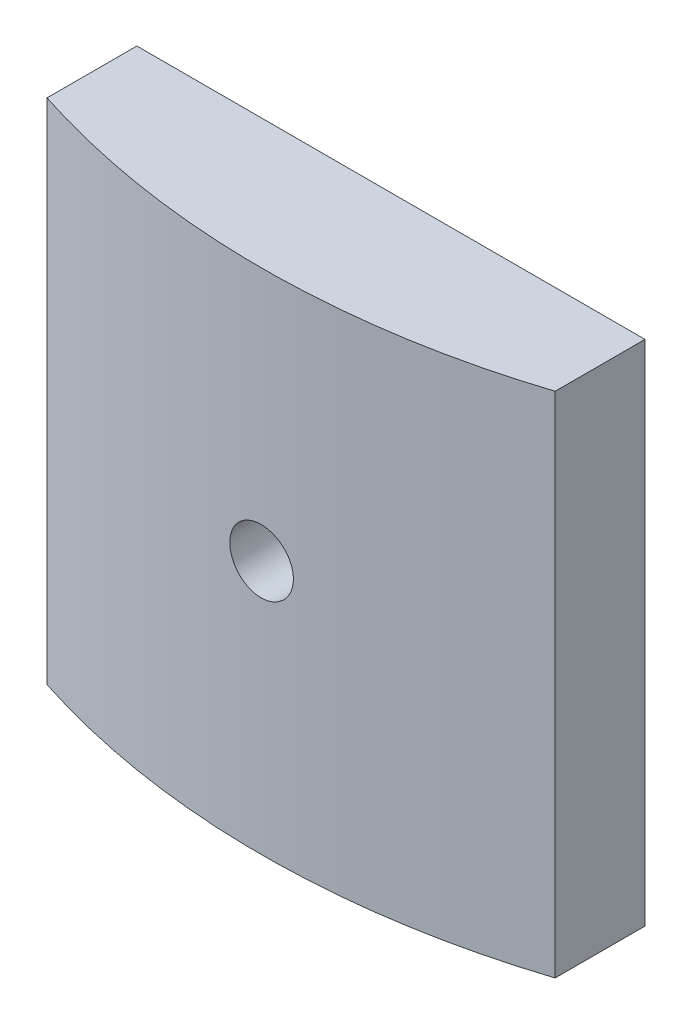
from build123d import *

# Parameters (mm, degrees)
BOSS_EXTRUDE1_DEPTH = 20
SKETCH3_R           = 1.25
CUT_EXTRUDE1_DEPTH  = 20


with BuildPart() as part:
    # Sketch2 → Boss-Extrude1 (new body)
    with BuildSketch(Plane(origin=(0, 0, 0), x_dir=(1, 0, 0), z_dir=(0, 1, 0))):
        with BuildLine():
            Line((0, -27.386127875), (-10, -27.386127875))
            Line((-10, -27.386127875), (-10, -30.923292192))
            ThreePointArc((-10, -30.923292192), (0, -32.5), (10, -30.923292192))
            Line((10, -30.923292192), (10, -27.386127875))
            Line((10, -27.386127875), (0, -27.386127875))
        make_face()
    extrude(amount=BOSS_EXTRUDE1_DEPTH)

    # Sketch3 → Cut-Extrude1 (cut)
    with BuildSketch(Plane(origin=(0, 0, 27.386127875), x_dir=(-1, 0, 0), z_dir=(0, 0, -1))):
        with Locations((0, 10)):
            Circle(SKETCH3_R)
    extrude(amount=-CUT_EXTRUDE1_DEPTH, mode=Mode.SUBTRACT)


solid = part.part
